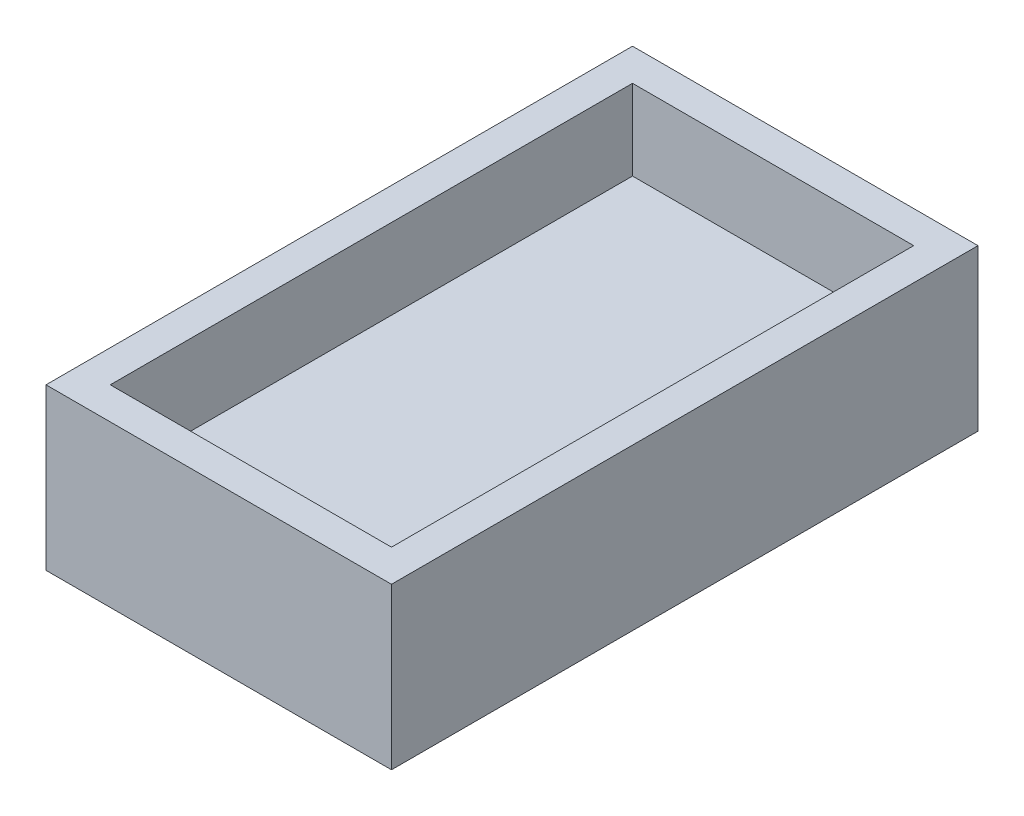
from build123d import *

# Parameters (mm, degrees)
SKETCH1_W           = 27.305
SKETCH1_H           = 46.355
SKETCH1_W_2         = 22.225
SKETCH1_H_2         = 41.275
BOSS_EXTRUDE1_DEPTH = 6.35
SKETCH3_W           = 27.305
SKETCH3_H           = 46.355
BOSS_EXTRUDE2_DEPTH = 6.35
SKETCH4_R           = 1.397
CUT_EXTRUDE1_DEPTH  = 6.35


with BuildPart() as part:
    # Sketch1 → Boss-Extrude1 (new body)
    with BuildSketch(Plane(origin=(0, 0, 0), x_dir=(1, 0, 0), z_dir=(0, 1, 0))):
        with Locations((30.966827497, 1.604730882)):
            Rectangle(SKETCH1_W, SKETCH1_H)
        with Locations((30.966827497, 1.604730882)):
            Rectangle(SKETCH1_W_2, SKETCH1_H_2, mode=Mode.SUBTRACT)
    extrude(amount=-BOSS_EXTRUDE1_DEPTH)

    # Sketch3 → Boss-Extrude2 (add)
    with BuildSketch(Plane(origin=(0, -6.35, 0), x_dir=(-1, 0, 0), z_dir=(0, -1, 0))):
        with Locations((-30.966827497, 1.604730882)):
            Rectangle(SKETCH3_W, SKETCH3_H)
    extrude(amount=BOSS_EXTRUDE2_DEPTH)

    # Sketch4 → Cut-Extrude1 (cut)
    with BuildSketch(Plane(origin=(0, -6.35, 0), x_dir=(1, 0, 0), z_dir=(0, 1, 0))):
        with Locations(Location((39.395825841, 19.093107215, 0), (0, 0, 270))):
            Circle(SKETCH4_R)
        with Locations(Location((39.395865865, -15.704892785, 0), (0, 0, 270))):
            Circle(SKETCH4_R)
    extrude(amount=-CUT_EXTRUDE1_DEPTH, mode=Mode.SUBTRACT)


solid = part.part
